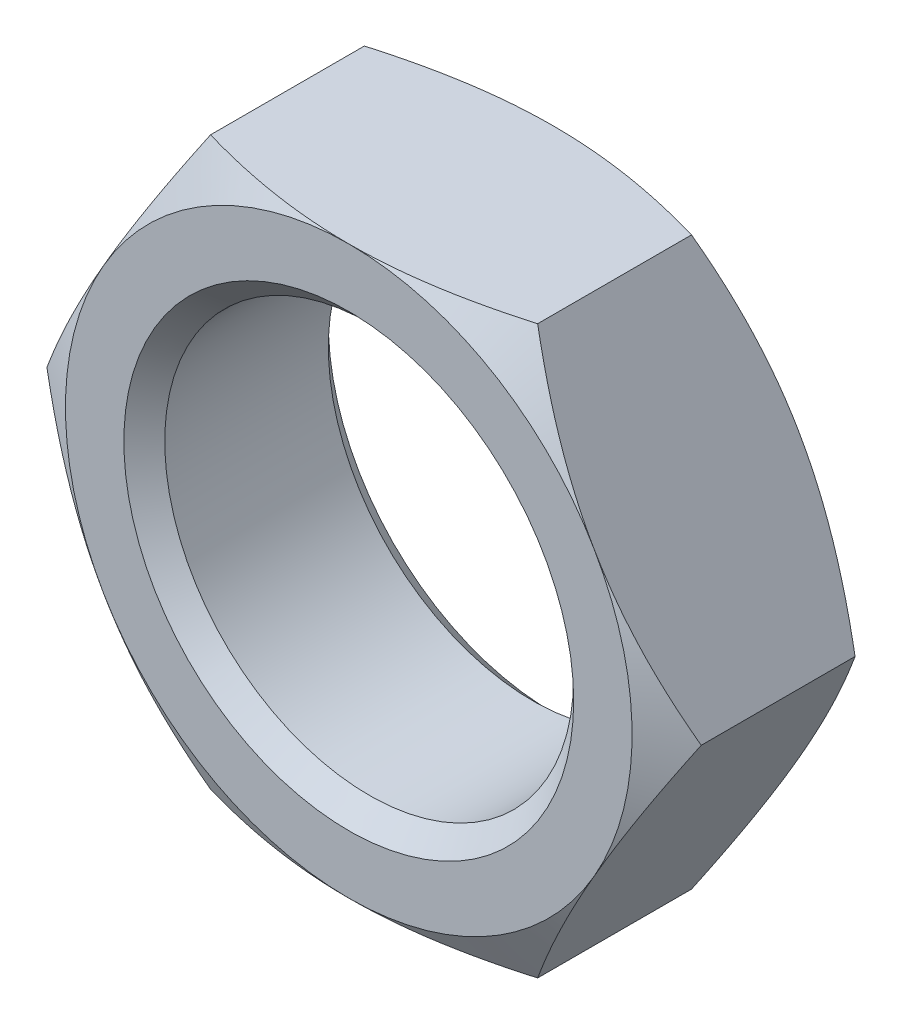
from build123d import *

# Parameters (mm, degrees)
DODANIE_WYCI_GNI_CIE1_DEPTH = 5
SZKIC2_R                    = 5
WYTNIJ_WYCI_GNI_CIE1_DEPTH  = 5
SFAZOWANIE1_SIZE            = 0.5
SZKIC6_OUTSIDE_W            = 56.99
SZKIC6_OUTSIDE_H            = 54.846
SZKIC6_OUTSIDE_R            = 6.92820323
WYTNIJ_WYCI_GNI_CIE2_DEPTH  = 10
WYTNIJ_WYCI_GNI_CIE2_DRAFT  = -60
SZKIC7_OUTSIDE_W            = 56.99
SZKIC7_OUTSIDE_H            = 54.846
SZKIC7_OUTSIDE_R            = 6.92820323
WYTNIJ_WYCI_GNI_CIE3_DEPTH  = 10
WYTNIJ_WYCI_GNI_CIE3_DRAFT  = -60


with BuildPart() as part:
    # Szkic1 → Dodanie-wyciągnięcie1 (new body)
    with BuildSketch(Plane.XY):
        Polygon((-4, 6.92820323), (-8, 0), (-4, -6.92820323), (4, -6.92820323), (8, 0), (4, 6.92820323), align=None)
    extrude(amount=DODANIE_WYCI_GNI_CIE1_DEPTH)

    # Szkic2 → Wytnij-wyciągnięcie1 (cut)
    with BuildSketch(Plane.XY.offset(5)):
        Circle(SZKIC2_R)
    extrude(amount=-WYTNIJ_WYCI_GNI_CIE1_DEPTH, mode=Mode.SUBTRACT)

    # Sfazowanie1
    sfazowanie1_edges = [part.edges().sort_by_distance(p)[0] for p in [
        (-5, 0, 0),
        (-5, 0, 5),
    ]]
    chamfer(sfazowanie1_edges, length=SFAZOWANIE1_SIZE)


with BuildPart() as wytnij_wyci_gni_cie2_tool:
    # Szkic6 outside → Wytnij-wyciągnięcie2 (with draft: the straight prism first)
    with BuildSketch(Plane(origin=(0, 0, 0), x_dir=(-1, 0, 0), z_dir=(0, 0, -1))):
        Rectangle(SZKIC6_OUTSIDE_W, SZKIC6_OUTSIDE_H)
        Circle(SZKIC6_OUTSIDE_R, mode=Mode.SUBTRACT)
    extrude(amount=-WYTNIJ_WYCI_GNI_CIE2_DEPTH)
    # Wytnij-wyciągnięcie2: the draft: its side faces are tilted about the plane it starts from
    wytnij_wyci_gni_cie2_sides = [wytnij_wyci_gni_cie2_tool.faces().sort_by_distance(p)[0] for p in [
        (0, -27.423, 5),
        (-28.495, 0, 5),
        (0, 27.423, 5),
        (28.495, 0, 5),
        (6.92820323, 0, 5),
    ]]
    draft(wytnij_wyci_gni_cie2_sides, Plane(origin=(0, 0, 0), x_dir=(-1, 0, 0), z_dir=(0, 0, -1)), WYTNIJ_WYCI_GNI_CIE2_DRAFT)


with BuildPart() as part_1:
    add(part.part)

    # Wytnij-wyciągnięcie2: cut by wytnij_wyci_gni_cie2_tool
    add(wytnij_wyci_gni_cie2_tool.part, mode=Mode.SUBTRACT)


with BuildPart() as wytnij_wyci_gni_cie3_tool:
    # Szkic7 outside → Wytnij-wyciągnięcie3 (with draft: the straight prism first)
    with BuildSketch(Plane.XY.offset(5)):
        Rectangle(SZKIC7_OUTSIDE_W, SZKIC7_OUTSIDE_H)
        Circle(SZKIC7_OUTSIDE_R, mode=Mode.SUBTRACT)
    extrude(amount=-WYTNIJ_WYCI_GNI_CIE3_DEPTH)
    # Wytnij-wyciągnięcie3: the draft: its side faces are tilted about the plane it starts from
    wytnij_wyci_gni_cie3_sides = [wytnij_wyci_gni_cie3_tool.faces().sort_by_distance(p)[0] for p in [
        (0, -27.423, 0),
        (28.495, 0, 0),
        (0, 27.423, 0),
        (-28.495, 0, 0),
        (-6.92820323, 0, 0),
    ]]
    draft(wytnij_wyci_gni_cie3_sides, Plane.XY.offset(5), WYTNIJ_WYCI_GNI_CIE3_DRAFT)


with BuildPart() as part_2:
    add(part_1.part)

    # Wytnij-wyciągnięcie3: cut by wytnij_wyci_gni_cie3_tool
    add(wytnij_wyci_gni_cie3_tool.part, mode=Mode.SUBTRACT)


solid = part_2.part
